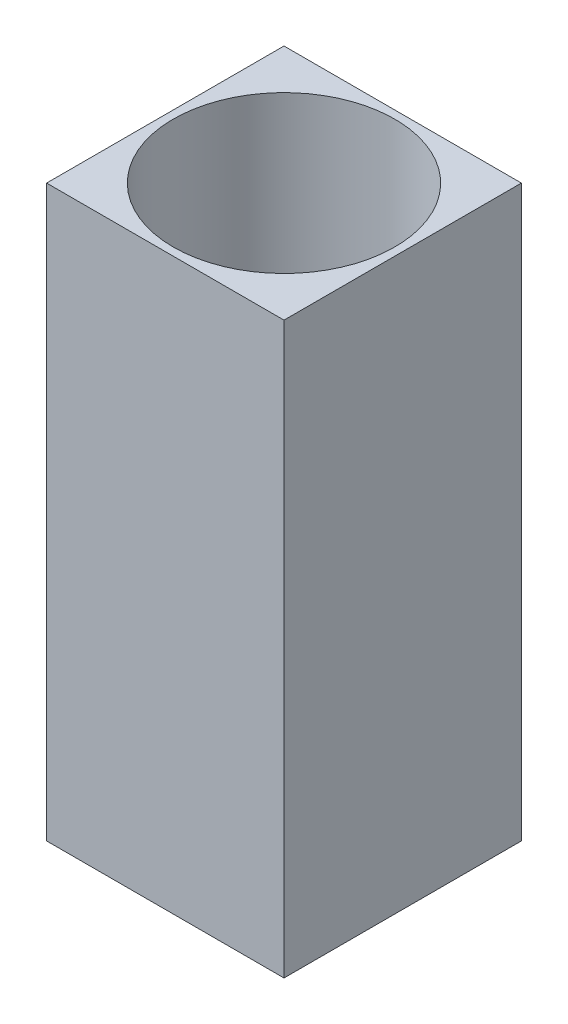
from build123d import *

# Parameters (mm, degrees)
SKETCH1_W           = 95.25
SKETCH1_H           = 95.25
SKETCH1_R           = 44.45
BOSS_EXTRUDE1_DEPTH = 215.9
SKETCH2_W           = 95.25
SKETCH2_H           = 95.25
BOSS_EXTRUDE2_DEPTH = 6.35
SKETCH4_W           = 95.25
SKETCH4_H           = 95.25
SKETCH4_R           = 44.45
BOSS_EXTRUDE4_DEPTH = 6.35


with BuildPart() as part:
    # Sketch1 → Boss-Extrude1 (new body)
    with BuildSketch(Plane(origin=(0, 0, 0), x_dir=(1, 0, 0), z_dir=(0, 1, 0))):
        with Locations((47.625, 47.625)):
            Rectangle(SKETCH1_W, SKETCH1_H)
        with Locations(Location((47.625, 47.625, 0), (0, 0, 270))):
            Circle(SKETCH1_R, mode=Mode.SUBTRACT)
    extrude(amount=BOSS_EXTRUDE1_DEPTH)

    # Sketch2 → Boss-Extrude2 (add)
    with BuildSketch(Plane.XZ):
        with Locations((47.625, -47.625)):
            Rectangle(SKETCH2_W, SKETCH2_H)
    extrude(amount=BOSS_EXTRUDE2_DEPTH)

    # Sketch4 → Boss-Extrude4 (add)
    with BuildSketch(Plane(origin=(0, 215.9, 0), x_dir=(1, 0, 0), z_dir=(0, 1, 0))):
        with Locations((47.625, 47.625)):
            Rectangle(SKETCH4_W, SKETCH4_H)
        with Locations(Location((47.625, 47.625, 0), (0, 0, 270))):
            Circle(SKETCH4_R, mode=Mode.SUBTRACT)
    extrude(amount=BOSS_EXTRUDE4_DEPTH)


solid = part.part
